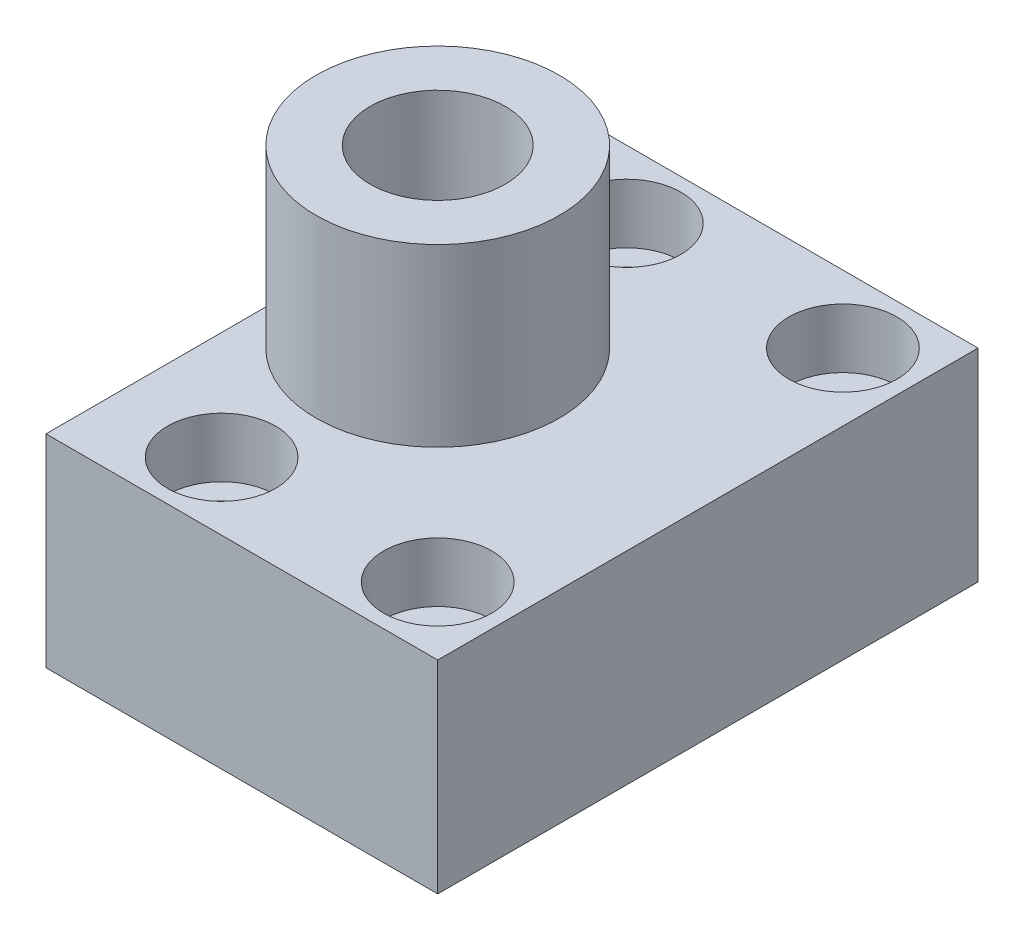
from build123d import *

# Parameters (mm, degrees)
EXTRUDE_1_DEPTH             = 40
SKETCH_9_R                  = 5
CUT_EXTRUDE_3_DEPTH         = 52.078371156
SKETCH_16_OUTSIDE_W         = 42.358
SKETCH_16_OUTSIDE_H         = 53.358
SKETCH_16_OUTSIDE_R         = 9
CUT_EXTRUDE_4_DEPTH         = 13
HOLE_WIZARD_M41_D           = 4.5
HOLE_WIZARD_M41_CBORE_D     = 8
HOLE_WIZARD_M41_CBORE_DEPTH = 4.4
SKETCH_19_R                 = 8
CUT_EXTRUDE_5_DEPTH         = 5


with BuildPart() as part:
    # Эскиз1 → Бобышка-Вытянуть1 (new body)
    with BuildSketch(Plane.XY):
        Polygon((7.5, 0), (7.5, -11), (15, -11), (15, -26), (-14, -26), (-14, 2), (0, 2), (7.5, 2), align=None)
    extrude(amount=EXTRUDE_1_DEPTH)

    # Эскиз9 → Вырез-Вытянуть3 (cut, through all)
    with BuildSketch(Plane(origin=(0, 2, 0), x_dir=(1, 0, 0), z_dir=(0, 1, 0))):
        with Locations(Location((-5, -20, 0), (0, 0, 180))):
            Circle(SKETCH_9_R)
    extrude(amount=-CUT_EXTRUDE_3_DEPTH, mode=Mode.SUBTRACT)

    # Эскиз16 outside → Вырез-Вытянуть4 (cut)
    with BuildSketch(Plane(origin=(0, 2, 0), x_dir=(1, 0, 0), z_dir=(0, 1, 0))):
        with Locations((0.5, -20)):
            Rectangle(SKETCH_16_OUTSIDE_W, SKETCH_16_OUTSIDE_H)
        with Locations(Location((-5, -20, 0), (0, 0, 180))):
            Circle(SKETCH_16_OUTSIDE_R, mode=Mode.SUBTRACT)
    extrude(amount=-CUT_EXTRUDE_4_DEPTH, mode=Mode.SUBTRACT)

    # Цековка для  винта с внутренним шестигранником M41 (through all)
    with Locations(Plane(origin=(0, -11, 0), x_dir=(-1, 0, 0), z_dir=(0, 1, 0))):
        with Locations((-10, 35), (-10, 5), (6, 35), (6, 5)):
            CounterBoreHole(HOLE_WIZARD_M41_D / 2, HOLE_WIZARD_M41_CBORE_D / 2, HOLE_WIZARD_M41_CBORE_DEPTH)

    # Эскиз19 → Вырез-Вытянуть5 (cut)
    with BuildSketch(Plane.XZ.offset(26)):
        with Locations(Location((-5, 20, 0), (0, 0, 270))):
            Circle(SKETCH_19_R)
    extrude(amount=-CUT_EXTRUDE_5_DEPTH, mode=Mode.SUBTRACT)


solid = part.part
